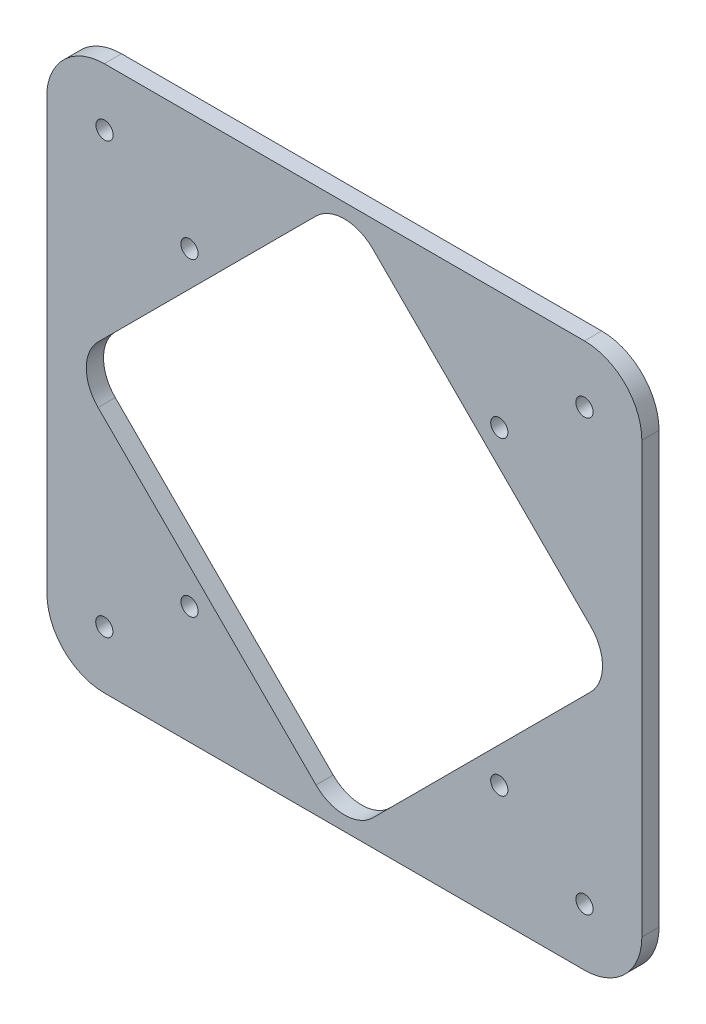
from build123d import *

# Parameters (mm, degrees)
SKETCH_1_R      = 1.5
EXTRUDE_1_DEPTH = 3


with BuildPart() as part:
    # 草圖1 → 填料-伸長1 (new body)
    with BuildSketch(Plane.XY):
        with BuildLine():
            Line((58.3003, 1), (142.0003, 1))
            ThreePointArc((142.0003, 1), (149.071310355, 3.928960355), (152.0002, 11))
            Line((152.0002, 11), (152.0002, 86))
            ThreePointArc((152.0002, 86), (149.071335355, 93.071064644), (142.0003, 96))
            Line((142.0003, 96), (58.3003, 96))
            ThreePointArc((58.3003, 96), (51.584341425, 93.406620638), (48.3003, 87))
            Line((48.3003, 87), (48.3003, 11))
            ThreePointArc((48.3003, 11), (51.22925, 3.92895), (58.3003, 1))
        make_face()
        with Locations((73.150306055, 21.499982809)):
            Circle(SKETCH_1_R, mode=Mode.SUBTRACT)
        with Locations((58.3003, 11)):
            Circle(SKETCH_1_R, mode=Mode.SUBTRACT)
        with Locations((142.000224541, 10.999975458)):
            Circle(SKETCH_1_R, mode=Mode.SUBTRACT)
        with Locations((127.150308327, 21.499982809)):
            Circle(SKETCH_1_R, mode=Mode.SUBTRACT)
        with Locations((142.000224541, 86)):
            Circle(SKETCH_1_R, mode=Mode.SUBTRACT)
        with Locations((127.150308327, 75.500030546)):
            Circle(SKETCH_1_R, mode=Mode.SUBTRACT)
        with Locations((73.150306055, 75.500030546)):
            Circle(SKETCH_1_R, mode=Mode.SUBTRACT)
        with Locations((58.342751992, 86)):
            Circle(SKETCH_1_R, mode=Mode.SUBTRACT)
        with BuildLine():
            Line((124.449289873, 24.90807964), (143.091425497, 43.550215264))
            ThreePointArc((143.091425497, 43.550215264), (145.141678029, 48.499962732), (143.091425497, 53.4497102))
            Line((143.091425497, 53.4497102), (105.100047468, 91.441088229))
            ThreePointArc((105.100047468, 91.441088229), (100.1503, 93.491340761), (95.200552532, 91.441088229))
            Line((95.200552532, 91.441088229), (76.558416908, 72.798952605))
            Line((76.558416908, 72.798952605), (57.209174503, 53.4497102))
            ThreePointArc((57.209174503, 53.4497102), (55.158921971, 48.499962732), (57.209174503, 43.550215264))
            Line((57.209174503, 43.550215264), (95.200552532, 5.558837235))
            ThreePointArc((95.200552532, 5.558837235), (100.1503, 3.508584704), (105.100047468, 5.558837235))
            Line((105.100047468, 5.558837235), (124.449289873, 24.90807964))
        make_face(mode=Mode.SUBTRACT)
    extrude(amount=EXTRUDE_1_DEPTH)


solid = part.part
